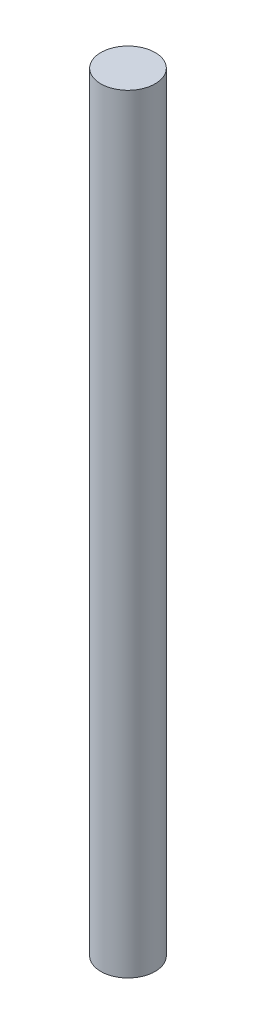
from build123d import *

# Parameters (mm, degrees)
SKETCH1_R           = 6
BOSS_EXTRUDE1_DEPTH = 170


with BuildPart() as part:
    # Sketch1 → Boss-Extrude1 (new body)
    with BuildSketch(Plane(origin=(0, 0, 0), x_dir=(1, 0, 0), z_dir=(0, 1, 0))):
        with Locations(Location((0, 0, 0), (0, 0, 270))):
            Circle(SKETCH1_R)
    extrude(amount=BOSS_EXTRUDE1_DEPTH)


solid = part.part
